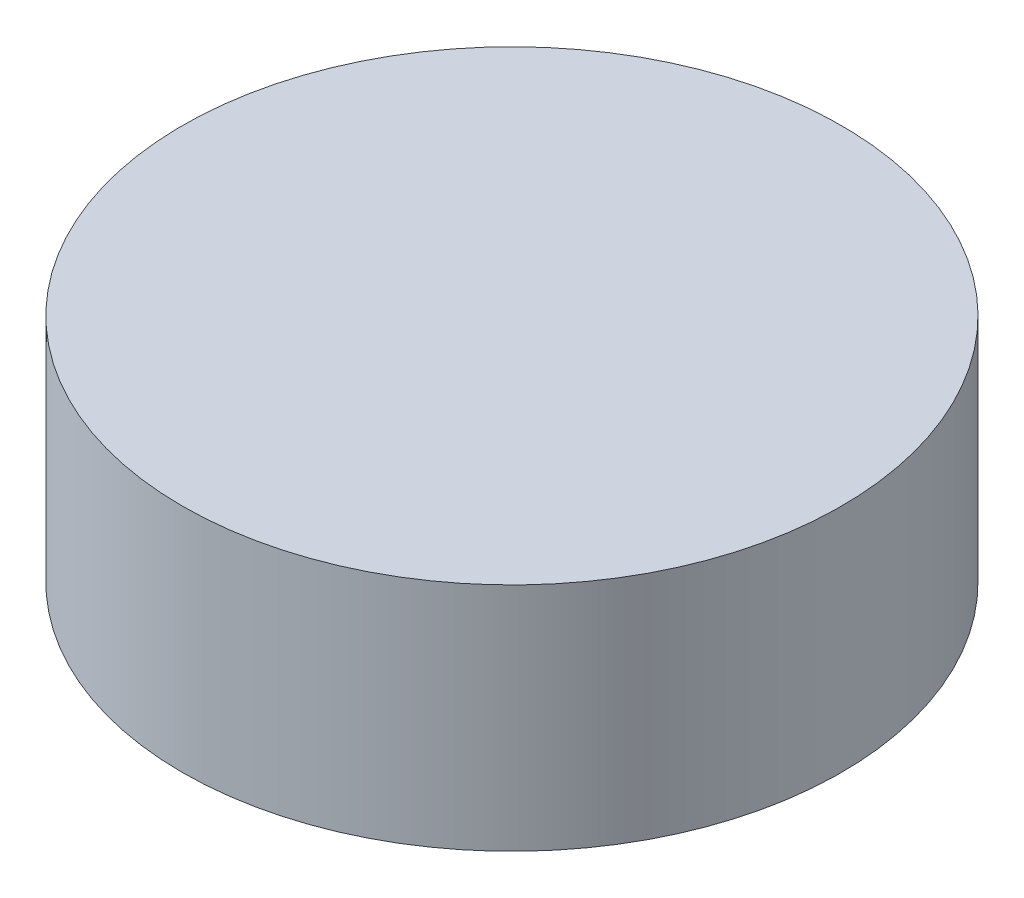
from build123d import *

# Parameters (mm, degrees)
ESQUISSE1_R        = 10
BOSS_EXTRU_1_DEPTH = 7


with BuildPart() as part:
    # Esquisse1 → Boss.-Extru.1 (new body)
    with BuildSketch(Plane(origin=(0, 0, 0), x_dir=(1, 0, 0), z_dir=(0, 1, 0))):
        with Locations(Location((0, 0, 0), (0, 0, 270))):
            Circle(ESQUISSE1_R)
    extrude(amount=BOSS_EXTRU_1_DEPTH)


solid = part.part
